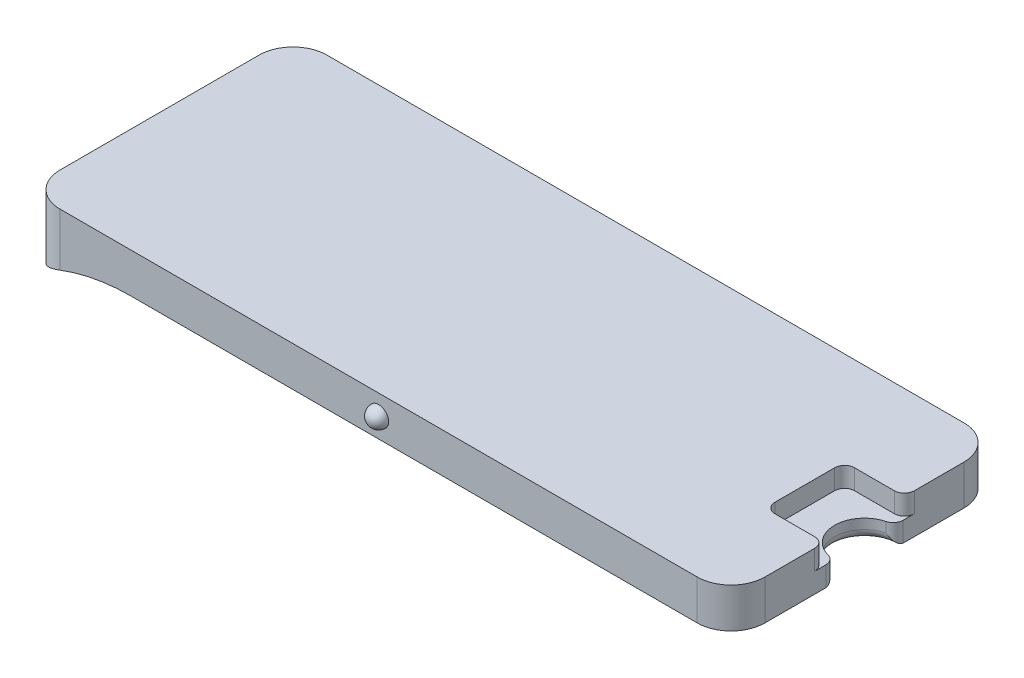
from build123d import *

# Parameters (mm, degrees)
AUFSATZ_LINEAR_AUSTRAGEN1_DEPTH = 6
SCHNITT_LINEAR_AUSTRAGEN1_DEPTH = 39.601165786
SKIZZE5_R                       = 1.5
SCHNITT_LINEAR_AUSTRAGEN2_DEPTH = 39.472457686
SKIZZE6_W                       = 3
SKIZZE6_H                       = 4
SCHNITT_LINEAR_AUSTRAGEN3_DEPTH = 1
VERRUNDUNG2_R                   = 0.5


with BuildPart() as part:
    # Skizze1 → Aufsatz-Linear austragen1 (new body)
    with BuildSketch(Plane(origin=(0, 0, 0), x_dir=(1, 0, 0), z_dir=(0, 1, 0))):
        with BuildLine():
            Line((2, 0.3), (34, 0.3))
            ThreePointArc((34, 0.3), (35.202081528, 0.797918472), (35.7, 2))
            Line((35.7, 2), (35.7, 12))
            ThreePointArc((35.7, 12), (35.202081528, 13.202081528), (34, 13.7))
            Line((34, 13.7), (2, 13.7))
            ThreePointArc((2, 13.7), (0.797918472, 13.202081528), (0.3, 12))
            Line((0.3, 12), (0.3, 2))
            ThreePointArc((0.3, 2), (0.797918472, 0.797918472), (2, 0.3))
        make_face()
    extrude(amount=AUFSATZ_LINEAR_AUSTRAGEN1_DEPTH)

    # Skizze2 → Schnitt-Linear austragen1 (cut, through all)
    with BuildSketch(Plane(origin=(0, 0, -13.7), x_dir=(-1, 0, 0), z_dir=(0, 0, -1))):
        with BuildLine():
            Line((-35.7, 0), (2.436435526, 0))
            ThreePointArc((2.436435526, 0), (-1.091428519, 2.94427191), (-5.563564474, 4))
            Line((-5.563564474, 4), (-35.7, 4))
            Line((-35.7, 4), (-35.7, 0))
        make_face()
    extrude(amount=-SCHNITT_LINEAR_AUSTRAGEN1_DEPTH, mode=Mode.SUBTRACT)

    # Skizze3 → Rotation1 (revolve)
    with BuildSketch(Plane(origin=(0, 0, -13.7), x_dir=(-1, 0, 0), z_dir=(0, 0, -1))):
        with BuildLine():
            Line((-18.5, 5), (-17.5, 5))
            ThreePointArc((-17.5, 5), (-18, 5.5), (-18.5, 5))
        make_face()
    rotation1 = revolve(axis=Axis((35.7, 5, -13.7), (-1, 0, 0)))

    # Skizze4 → Rotation2 (revolve)
    with BuildSketch(Plane.ZY.offset(-0.3)):
        with BuildLine():
            Line((-7, 3.75132006), (-7, 4.75132006))
            ThreePointArc((-7, 4.75132006), (-7.5, 4.25132006), (-7, 3.75132006))
        make_face()
    revolve(axis=Axis((0.3, 2.502640121, -7), (0, 1, 0)))

    # Spiegeln1: Rotation1 across plane
    add(rotation1.mirror(Plane(origin=(0, 0, -7), x_dir=(1, 0, 0), z_dir=(0, 0, -1))))

    # Skizze5 → Schnitt-Linear austragen2 (cut, through all)
    with BuildSketch(Plane.XZ.offset(-4)):
        with Locations((35.7, -7)):
            Circle(SKIZZE5_R)
    extrude(amount=-SCHNITT_LINEAR_AUSTRAGEN2_DEPTH, mode=Mode.SUBTRACT)

    # Skizze6 → Schnitt-Linear austragen3 (cut)
    with BuildSketch(Plane(origin=(0, 6, 0), x_dir=(1, 0, 0), z_dir=(0, 1, 0))):
        with Locations((34.2, 7)):
            Rectangle(SKIZZE6_W, SKIZZE6_H)
    extrude(amount=-SCHNITT_LINEAR_AUSTRAGEN3_DEPTH, mode=Mode.SUBTRACT)

    # Verrundung2
    verrundung2_edges = [part.edges().sort_by_distance(p)[0] for p in [
        (34.2, 4, -7),
        (35.7, 4.5, -5.5),
        (35.7, 4.5, -8.5),
        (35.7, 5.5, -9),
        (35.7, 5.5, -5),
        (32.7, 5.5, -5),
        (32.7, 5.5, -9),
    ]]
    fillet(verrundung2_edges, radius=VERRUNDUNG2_R)


solid = part.part
